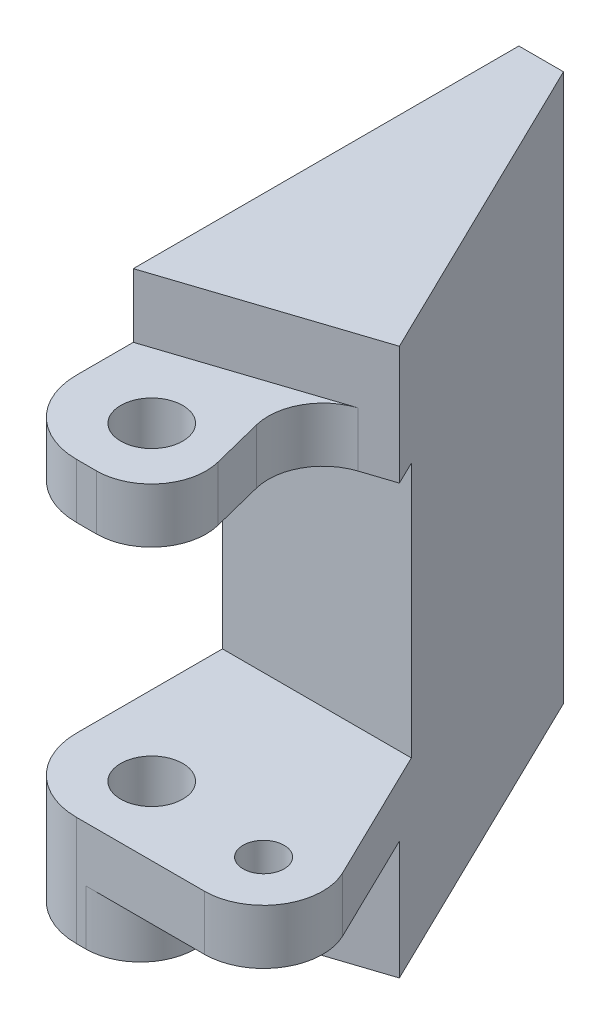
from build123d import *

# Parameters (mm, degrees)
SKETCH1_R           = 1.7000000000000015
SKETCH1_R_2         = 1.1249999999999982
BOSS_EXTRUDE1_DEPTH = 30
CUT_EXTRUDE1_DEPTH  = 3.5
CUT_EXTRUDE2_DEPTH  = 3.5
FILLET1_R           = 4
SKETCH6_W           = 16.8927871134671
SKETCH6_H           = 14
CUT_EXTRUDE3_DEPTH  = 96.70345562354154
CUT_EXTRUDE4_DEPTH  = 3
FILLET2_R           = 3
FILLET3_R           = 3
CUT_EXTRUDE7_DEPTH  = 10
FILLET4_R           = 3
FILLET5_R           = 3


with BuildPart() as part:
    # Sketch1 → Boss-Extrude1 (new body)
    with BuildSketch(Plane(origin=(0, 0, 0), x_dir=(1, 0, 0), z_dir=(0, 1, 0))):
        with BuildLine():
            Line((-67.41726719036473, 89.75450030463905), (-64.96978375504433, 89.75450030463905))
            Line((-64.96978375504433, 89.75450030463905), (-53.48663897336089, 66.16198945077305))
            ThreePointArc((-53.48663897336089, 66.16198945077305), (-53.65304900524508, 63.02325116523408), (-56.40241603973214, 61.499981250381275))
            Line((-56.40241603973214, 61.499981250381275), (-67.41726719036473, 61.499981250381275))
            Line((-67.41726719036473, 61.499981250381275), (-67.41726719036473, 89.75450030463905))
        make_face()
        with Locations(Location((-63.06696708972735, 65.27360292976877, 0), (0, 0, 270))):
            Circle(SKETCH1_R, mode=Mode.SUBTRACT)
        with Locations(Location((-56.40241603973214, 64.74279797888421, 0), (0, 0, 270))):
            Circle(SKETCH1_R_2, mode=Mode.SUBTRACT)
    extrude(amount=BOSS_EXTRUDE1_DEPTH)

    # Sketch4 → Cut-Extrude1 (cut)
    with BuildSketch(Plane(origin=(0, 0, 0), x_dir=(-1, 0, 0), z_dir=(0, -1, 0))):
        Polygon((56.36085478477071, 72.24701778462617), (67.25774228220871, 68.66563773680312), (67.56486364186908, 68.5646989769961), (68.07491191484384, 60.66505530671413), (50.67511099214203, 61.303323516745735), (50.323559595932146, 66.74816258197976), align=None)
    extrude(amount=-CUT_EXTRUDE1_DEPTH, mode=Mode.SUBTRACT)

    # Sketch5 → Cut-Extrude2 (cut)
    with BuildSketch(Plane(origin=(0, 30, 0), x_dir=(1, 0, 0), z_dir=(0, 1, 0))):
        Polygon((-56.36085478477071, 72.24701778462617), (-67.25774228220871, 68.66563773680312), (-69.83403727288335, 67.81891049665515), (-69.83403727288335, 60.473378762572615), (-51.53143062922566, 60.473378762572615), (-50.58101521609465, 66.57187766349658), align=None)
    extrude(amount=-CUT_EXTRUDE2_DEPTH, mode=Mode.SUBTRACT)

    # Fillet1
    fillet1_edges = [part.edges().sort_by_distance(p)[0] for p in [
        (-67.41726719036473, 15, -61.499981250381275),
    ]]
    fillet(fillet1_edges, radius=FILLET1_R)

    # Sketch6 → Cut-Extrude3 (cut, through all)
    with BuildSketch(Plane.ZY.offset(67.41726719036473)):
        with Locations((-65.05358769364771, 16.5)):
            Rectangle(SKETCH6_W, SKETCH6_H)
    extrude(amount=-CUT_EXTRUDE3_DEPTH, mode=Mode.SUBTRACT)

    # Sketch7 → Cut-Extrude4 (cut)
    with BuildSketch(Plane(origin=(0, 3.5, 0), x_dir=(-1, 0, 0), z_dir=(0, -1, 0))):
        Polygon((56.43632253896984, 72.22221449018052), (53.48663897336088, 66.16198945077305), (50.72300756793861, 60.4840148917036), (56.40241603973214, 61.499981250381275), (59.909841615048435, 61.499981250381275), (59.909841615048435, 70.20099101348265), (59.909841615048435, 71.08060484084474), align=None)
    extrude(amount=-CUT_EXTRUDE4_DEPTH, mode=Mode.SUBTRACT)

    # Fillet2
    fillet2_edges = [part.edges().sort_by_distance(p)[0] for p in [
        (-59.909841615048435, 5, -61.499981250381275),
    ]]
    fillet(fillet2_edges, radius=FILLET2_R)

    # Fillet3
    fillet3_edges = [part.edges().sort_by_distance(p)[0] for p in [
        (-59.909841615048435, 5, -71.08060484084474),
    ]]
    fillet(fillet3_edges, radius=FILLET3_R)

    # Sketch8 → Cut-Extrude7 (cut)
    with BuildSketch(Plane(origin=(0, 26.5, 0), x_dir=(1, 0, 0), z_dir=(0, 1, 0))):
        Polygon((-59.61138736288163, 71.17869506194207), (-60.80258919639462, 70.78719368317894), (-58.46431809995156, 61.499981250381275), (-56.120645243524336, 59.6371858222966), (-50.85616204416965, 63.63562557653779), (-56.436322538969726, 72.22221449018029), align=None)
    extrude(amount=-CUT_EXTRUDE7_DEPTH, mode=Mode.SUBTRACT)

    # Fillet4
    fillet4_edges = [part.edges().sort_by_distance(p)[0] for p in [
        (-58.46431809995156, 25, -61.499981250381275),
    ]]
    fillet(fillet4_edges, radius=FILLET4_R)

    # Fillet5
    fillet5_edges = [part.edges().sort_by_distance(p)[0] for p in [
        (-60.80258919639462, 25, -70.78719368317894),
    ]]
    fillet(fillet5_edges, radius=FILLET5_R)


solid = part.part
